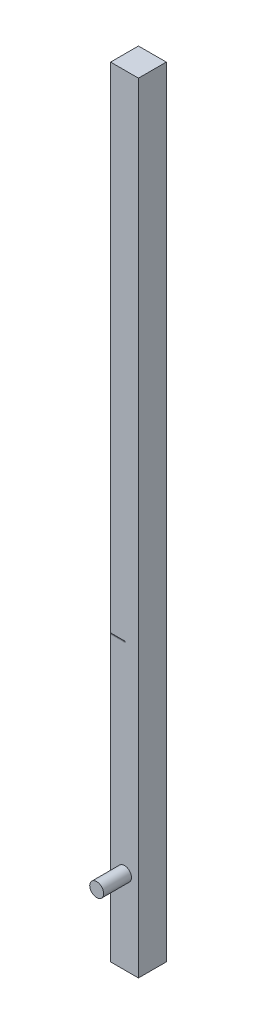
from build123d import *

# Parameters (mm, degrees)
SKETCH_1_W      = 10
SKETCH_1_H      = 10
EXTRUDE_1_DEPTH = 280
SKETCH_2_R      = 2.5
EXTRUDE_2_DEPTH = 10
SKETCH_3_W      = 5.326066841
SKETCH_3_H      = 0.31329805
EXTRUDE_3_DEPTH = 0.1


with BuildPart() as part:
    # 草图1 → 凸台-拉伸1 (new body)
    with BuildSketch(Plane(origin=(0, 0, 0), x_dir=(1, 0, 0), z_dir=(0, 1, 0))):
        Rectangle(SKETCH_1_W, SKETCH_1_H)
    extrude(amount=EXTRUDE_1_DEPTH)

    # 草图2 → 凸台-拉伸2 (add)
    with BuildSketch(Plane.XY.offset(5)):
        with Locations(Location((0, 30, 0), (0, 0, 180))):
            Circle(SKETCH_2_R)
    extrude(amount=EXTRUDE_2_DEPTH)

    # 草图3 → 凸台-拉伸3 (add)
    with BuildSketch(Plane.XY.offset(5)):
        with Locations((-2.223790566, 102.242298207)):
            Rectangle(SKETCH_3_W, SKETCH_3_H)
    extrude(amount=EXTRUDE_3_DEPTH)


solid = part.part
